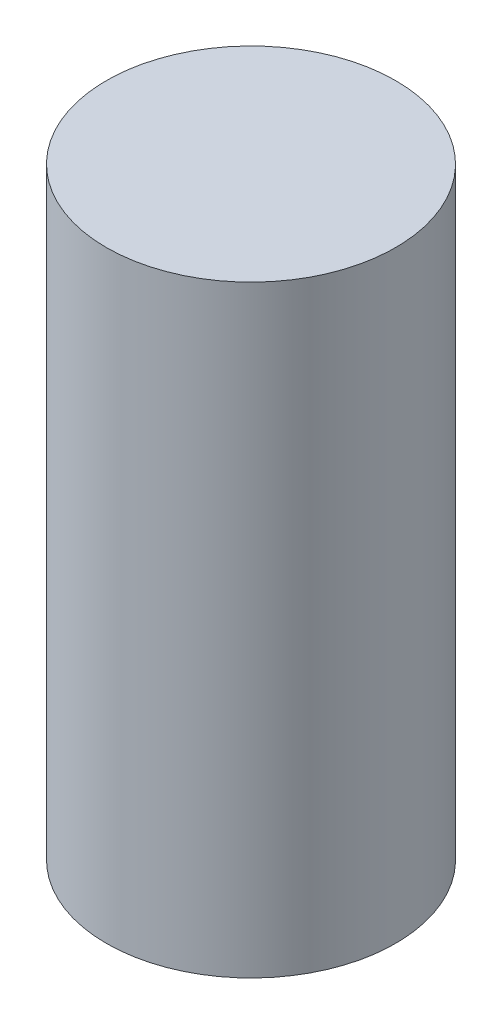
from build123d import *

# Parameters (mm, degrees)
SKETCH_1_R      = 6
EXTRUDE_1_DEPTH = 25


with BuildPart() as part:
    # 草图1 → 凸台-拉伸1 (new body)
    with BuildSketch(Plane(origin=(0, 0, 0), x_dir=(1, 0, 0), z_dir=(0, 1, 0))):
        with Locations(Location((0, 0, 0), (0, 0, 270))):
            Circle(SKETCH_1_R)
    extrude(amount=EXTRUDE_1_DEPTH)


solid = part.part
